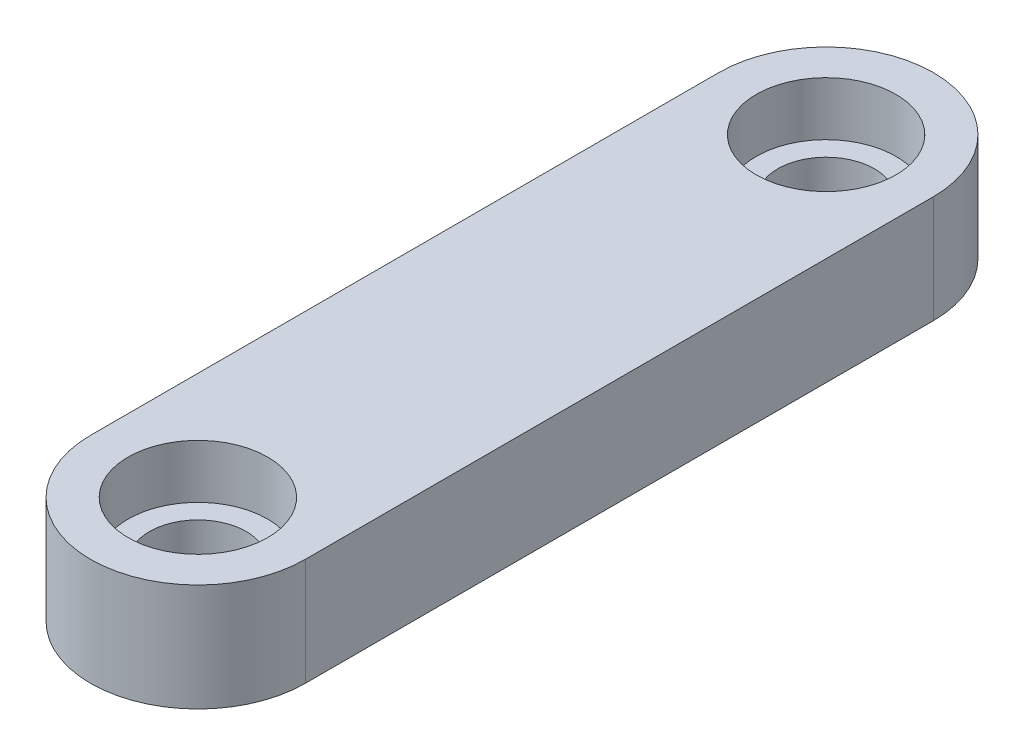
from build123d import *

# Parameters (mm, degrees)
SKETCH_1_W          = 20
SKETCH_1_H          = 10
EXTRUDE_1_DEPTH     = 80.297387422
SKETCH_2_R          = 6.5
CUT_EXTRUDE_1_DEPTH = 5
SKETCH_3_R          = 4.5
CUT_EXTRUDE_2_DEPTH = 20


with BuildPart() as part:
    # 스케치1 → 보스-돌출1 (new body)
    with BuildSketch(Plane.XY):
        Rectangle(SKETCH_1_W, SKETCH_1_H)
    extrude(amount=EXTRUDE_1_DEPTH)

    # 스케치2 → 컷-돌출1 (cut)
    with BuildSketch(Plane(origin=(0, 5, 0), x_dir=(1, 0, 0), z_dir=(0, 1, 0))):
        with Locations(Location((0, -10.902706153, 0), (0, 0, 270))):
            Circle(SKETCH_2_R)
    cut_extrude_1 = extrude(amount=-CUT_EXTRUDE_1_DEPTH, mode=Mode.SUBTRACT)

    # 스케치3 → 컷-돌출2 (cut)
    with BuildSketch(Plane(origin=(0, 5, 0), x_dir=(1, 0, 0), z_dir=(0, 1, 0))):
        with Locations(Location((0, -10.902706153, 0), (0, 0, 270))):
            Circle(SKETCH_3_R)
        with BuildLine():
            Line((-21.262122506, -10.902706153), (-10, -10.902706153))
            ThreePointArc((-10, -10.902706153), (0, -0.902706153), (10, -10.902706153))
            Line((10, -10.902706153), (21.262122506, -10.902706153))
            ThreePointArc((21.262122506, -10.902706153), (0, 10.359416353), (-21.262122506, -10.902706153))
        make_face()
    cut_extrude_2 = extrude(amount=-CUT_EXTRUDE_2_DEPTH, mode=Mode.SUBTRACT)

    # 대칭 복사1: 컷-돌출1, 컷-돌출2 across plane
    add(cut_extrude_1.mirror(Plane.XY.offset(40.148693711)), mode=Mode.SUBTRACT)
    add(cut_extrude_2.mirror(Plane.XY.offset(40.148693711)), mode=Mode.SUBTRACT)


solid = part.part
